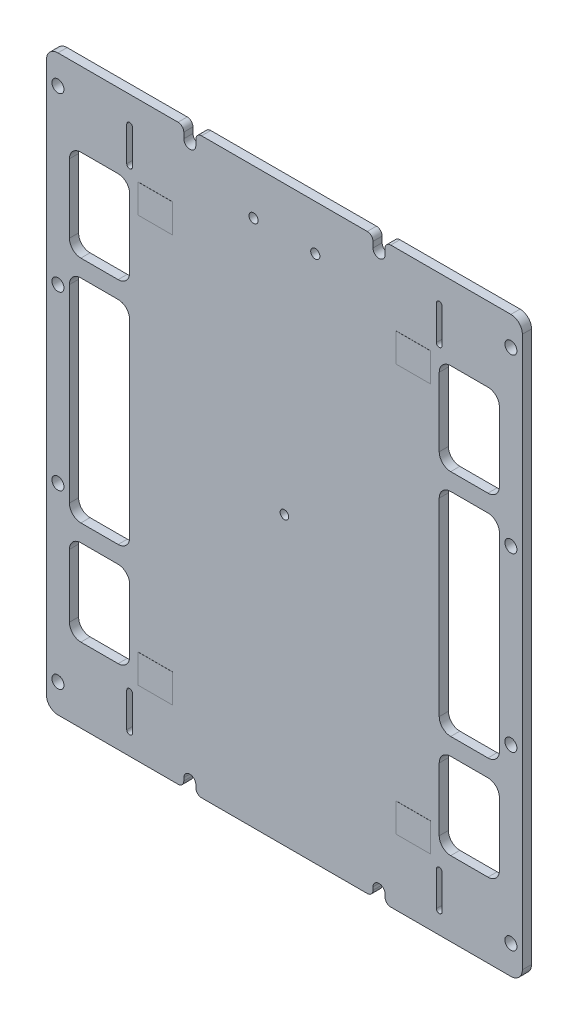
from build123d import *

# Parameters (mm, degrees)
BOARDOUTLINE_DEPTH          = 1.6
SKETCH2_R                   = 0.75
SKETCH2_R_2                 = 0.8
COMPONENTHOLES_DEPTH        = 65.998538445
SOLARCELLCONTACTHOLES_DEPTH = 1.6
WINDOWS_1SIDE_DEPTH         = 65.998538445
SKETCH5_W                   = 6
SKETCH5_H                   = 5
CONTACTPADS_DEPTH           = 0.02
M2_CLEARANCE_HOLE1_D        = 2.1
CUT_EXTRUDE1_DEPTH          = 65.999033839
FILLET3_R                   = 1
FILLET3_OF_MIRROR1_R        = 1


with BuildPart() as part:
    # Sketch1 → boardOutline (new body)
    with BuildSketch(Plane.XY):
        with BuildLine():
            Line((-39.5, -50), (39.5, -50))
            ThreePointArc((39.5, -50), (40.914213562, -49.414213562), (41.5, -48))
            Line((41.5, -48), (41.5, 48))
            ThreePointArc((41.5, 48), (40.914213562, 49.414213562), (39.5, 50))
            Line((39.5, 50), (-39.5, 50))
            ThreePointArc((-39.5, 50), (-40.914213562, 49.414213562), (-41.5, 48))
            Line((-41.5, 48), (-41.5, -48))
            ThreePointArc((-41.5, -48), (-40.914213562, -49.414213562), (-39.5, -50))
        make_face()
    extrude(amount=BOARDOUTLINE_DEPTH)

    # Sketch2 → componentHoles (cut, through all)
    with BuildSketch(Plane.XY.offset(1.6)):
        Circle(SKETCH2_R)
        with Locations((-5.385, 42.1)):
            Circle(SKETCH2_R_2)
        with Locations((5.385, 42.1)):
            Circle(SKETCH2_R_2)
    extrude(amount=-COMPONENTHOLES_DEPTH, mode=Mode.SUBTRACT)

    # Sketch4 → solarCellContactHoles (cut)
    with BuildSketch(Plane.XY.offset(1.6)):
        with BuildLine():
            Line((-27.5, 39.25), (-27.5, 45.25))
            ThreePointArc((-27.5, 45.25), (-27, 45.75), (-26.5, 45.25))
            Line((-26.5, 45.25), (-26.5, 39.25))
            ThreePointArc((-26.5, 39.25), (-27, 38.75), (-27.5, 39.25))
        make_face()
        with BuildLine():
            Line((26.5, 39.25), (26.5, 45.25))
            ThreePointArc((26.5, 45.25), (27, 45.75), (27.5, 45.25))
            Line((27.5, 45.25), (27.5, 39.25))
            ThreePointArc((27.5, 39.25), (27, 38.75), (26.5, 39.25))
        make_face()
        with BuildLine():
            Line((26.5, -46.25), (26.5, -40.25))
            ThreePointArc((26.5, -40.25), (27, -39.75), (27.5, -40.25))
            Line((27.5, -40.25), (27.5, -46.25))
            ThreePointArc((27.5, -46.25), (27, -46.75), (26.5, -46.25))
        make_face()
        with BuildLine():
            Line((-27.5, -46.25), (-27.5, -40.25))
            ThreePointArc((-27.5, -40.25), (-27, -39.75), (-26.5, -40.25))
            Line((-26.5, -40.25), (-26.5, -46.25))
            ThreePointArc((-26.5, -46.25), (-27, -46.75), (-27.5, -46.25))
        make_face()
    extrude(amount=-SOLARCELLCONTACTHOLES_DEPTH, mode=Mode.SUBTRACT)

    # Sketch3 → windows_1side (cut, through all)
    with BuildSketch(Plane.XY.offset(1.6)):
        with BuildLine():
            Line((-35.5, 37), (-29, 37))
            ThreePointArc((-29, 37), (-27.585786438, 36.414213562), (-27, 35))
            Line((-27, 35), (-27, 23))
            ThreePointArc((-27, 23), (-27.585786438, 21.585786438), (-29, 21))
            Line((-29, 21), (-35.5, 21))
            ThreePointArc((-35.5, 21), (-36.914213562, 21.585786438), (-37.5, 23))
            Line((-37.5, 23), (-37.5, 35))
            ThreePointArc((-37.5, 35), (-36.914213562, 36.414213562), (-35.5, 37))
        make_face()
        with BuildLine():
            Line((-29, -22), (-35.5, -22))
            ThreePointArc((-35.5, -22), (-36.914213562, -22.585786438), (-37.5, -24))
            Line((-37.5, -24), (-37.5, -35))
            ThreePointArc((-37.5, -35), (-36.914213562, -36.414213562), (-35.5, -37))
            Line((-35.5, -37), (-29, -37))
            ThreePointArc((-29, -37), (-27.585786438, -36.414213562), (-27, -35))
            Line((-27, -35), (-27, -24))
            ThreePointArc((-27, -24), (-27.585786438, -22.585786438), (-29, -22))
        make_face()
        with BuildLine():
            Line((-29, -19), (-35.5, -19))
            ThreePointArc((-35.5, -19), (-36.914213562, -18.414213562), (-37.5, -17))
            Line((-37.5, -17), (-37.5, 16))
            ThreePointArc((-37.5, 16), (-36.914213562, 17.414213562), (-35.5, 18))
            Line((-35.5, 18), (-29, 18))
            ThreePointArc((-29, 18), (-27.585786438, 17.414213562), (-27, 16))
            Line((-27, 16), (-27, -17))
            ThreePointArc((-27, -17), (-27.585786438, -18.414213562), (-29, -19))
        make_face()
    windows_1side = extrude(amount=-WINDOWS_1SIDE_DEPTH, mode=Mode.SUBTRACT)

    # Sketch5 → contactPads (add)
    with BuildSketch(Plane.XY.offset(1.6)):
        with Locations((-22.5, 35)):
            Rectangle(SKETCH5_W, SKETCH5_H)
        with Locations((22.5, 35)):
            Rectangle(SKETCH5_W, SKETCH5_H)
        with Locations((22.5, -36)):
            Rectangle(SKETCH5_W, SKETCH5_H)
        with Locations((-22.5, -36)):
            Rectangle(SKETCH5_W, SKETCH5_H)
    extrude(amount=CONTACTPADS_DEPTH)

    # M2 Clearance Hole1 (through all)
    with Locations(Plane(origin=(0, 0, 0), x_dir=(-1, 0, 0), z_dir=(0, 0, -1))):
        with Locations((39.5, 45), (39.5, -15), (39.5, -45), (39.5, 15)):
            m2_clearance_hole1 = Hole(M2_CLEARANCE_HOLE1_D / 2)

    # Sketch10 → Cut-Extrude1 (cut, symmetric)
    with BuildSketch(Plane(origin=(0, 0, 0), x_dir=(-1, 0, 0), z_dir=(0, 0, -1))):
        with BuildLine():
            Line((15.45, 48), (15.45, 55.073166109))
            ThreePointArc((15.45, 55.073166109), (16.5, 56.123166109), (17.55, 55.073166109))
            Line((17.55, 55.073166109), (17.55, 48))
            ThreePointArc((17.55, 48), (16.5, 46.95), (15.45, 48))
        make_face()
        with BuildLine():
            Line((17.55, -48.5), (17.55, -55.573166109))
            ThreePointArc((17.55, -55.573166109), (16.5, -56.623166109), (15.45, -55.573166109))
            Line((15.45, -55.573166109), (15.45, -48.5))
            ThreePointArc((15.45, -48.5), (16.5, -47.45), (17.55, -48.5))
        make_face()
    cut_extrude1 = extrude(amount=CUT_EXTRUDE1_DEPTH, both=True, mode=Mode.SUBTRACT)

    # Fillet3
    fillet3_edges = [part.edges().sort_by_distance(p)[0] for p in [
        (-15.45, 50, 0.8),
        (-17.55, 50, 0.8),
        (-17.55, -50, 0.8),
        (-15.45, -50, 0.8),
    ]]
    fillet(fillet3_edges, radius=FILLET3_R)

    # Mirror1: windows_1side, M2 Clearance Hole1, Cut-Extrude1 across plane
    add(windows_1side.mirror(Plane(origin=(0, 0, 0), x_dir=(0, 0, 1), z_dir=(1, 0, 0))), mode=Mode.SUBTRACT)
    add(m2_clearance_hole1.mirror(Plane(origin=(0, 0, 0), x_dir=(0, 0, 1), z_dir=(1, 0, 0))), mode=Mode.SUBTRACT)
    add(cut_extrude1.mirror(Plane(origin=(0, 0, 0), x_dir=(0, 0, 1), z_dir=(1, 0, 0))), mode=Mode.SUBTRACT)

    # Fillet3 of Mirror1
    fillet3_of_mirror1_edges = [part.edges().sort_by_distance(p)[0] for p in [
        (15.45, 50, 0.8),
        (17.55, 50, 0.8),
        (17.55, -50, 0.8),
        (15.45, -50, 0.8),
    ]]
    fillet(fillet3_of_mirror1_edges, radius=FILLET3_OF_MIRROR1_R)


solid = part.part
